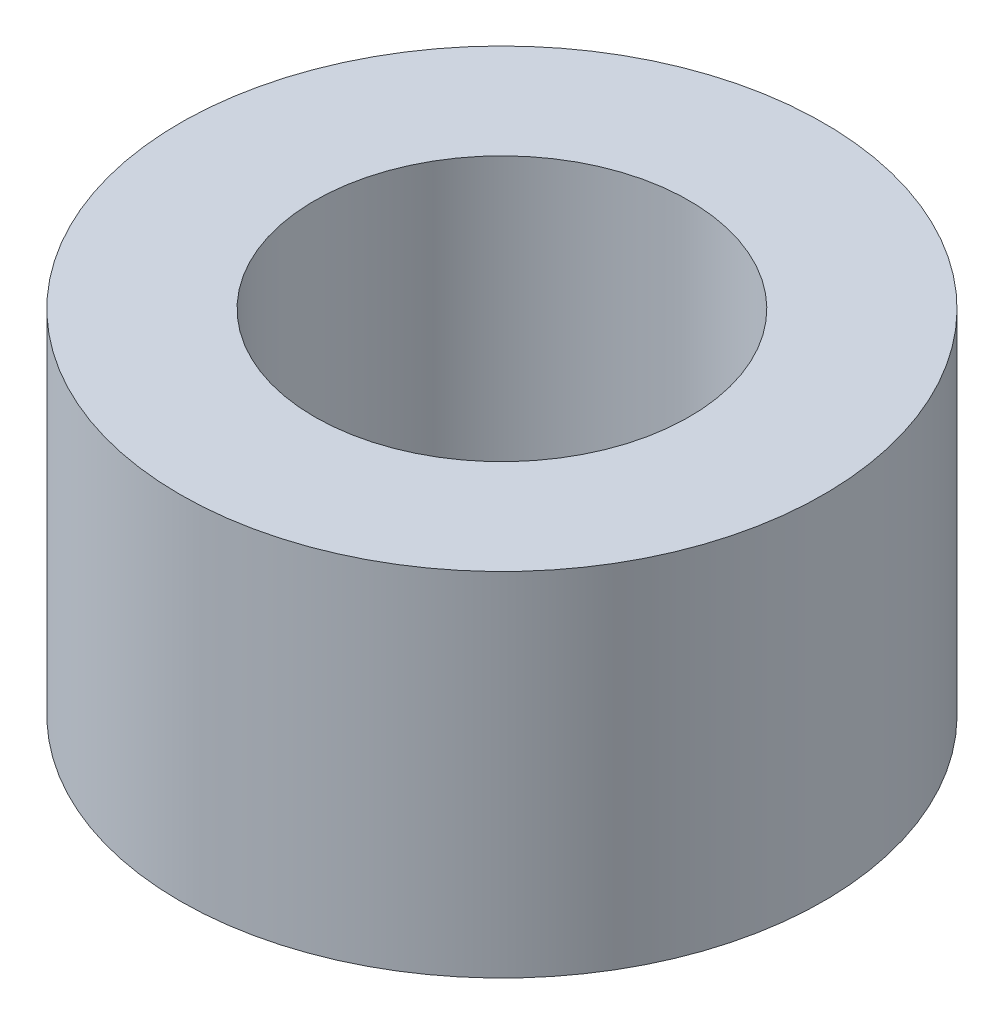
from build123d import *

# Parameters (mm, degrees)
SKETCH1_R               = 5.8039
BOSS_EXTRUDE1_DEPTH     = 6.35
F_1_4_CLEARANCE_HOLE1_D = 6.7564


with BuildPart() as part:
    # Sketch1 → Boss-Extrude1 (new body)
    with BuildSketch(Plane(origin=(0, 0, 0), x_dir=(1, 0, 0), z_dir=(0, 1, 0))):
        with Locations(Location((0, 0, 0), (0, 0, 270))):
            Circle(SKETCH1_R)
    extrude(amount=BOSS_EXTRUDE1_DEPTH)

    # 1/4 Clearance Hole1 (through all)
    with Locations(Plane(origin=(0, 6.35, 0), x_dir=(1, 0, 0), z_dir=(0, 1, 0))):
        with Locations((0, 0)):
            Hole(F_1_4_CLEARANCE_HOLE1_D / 2)


solid = part.part
